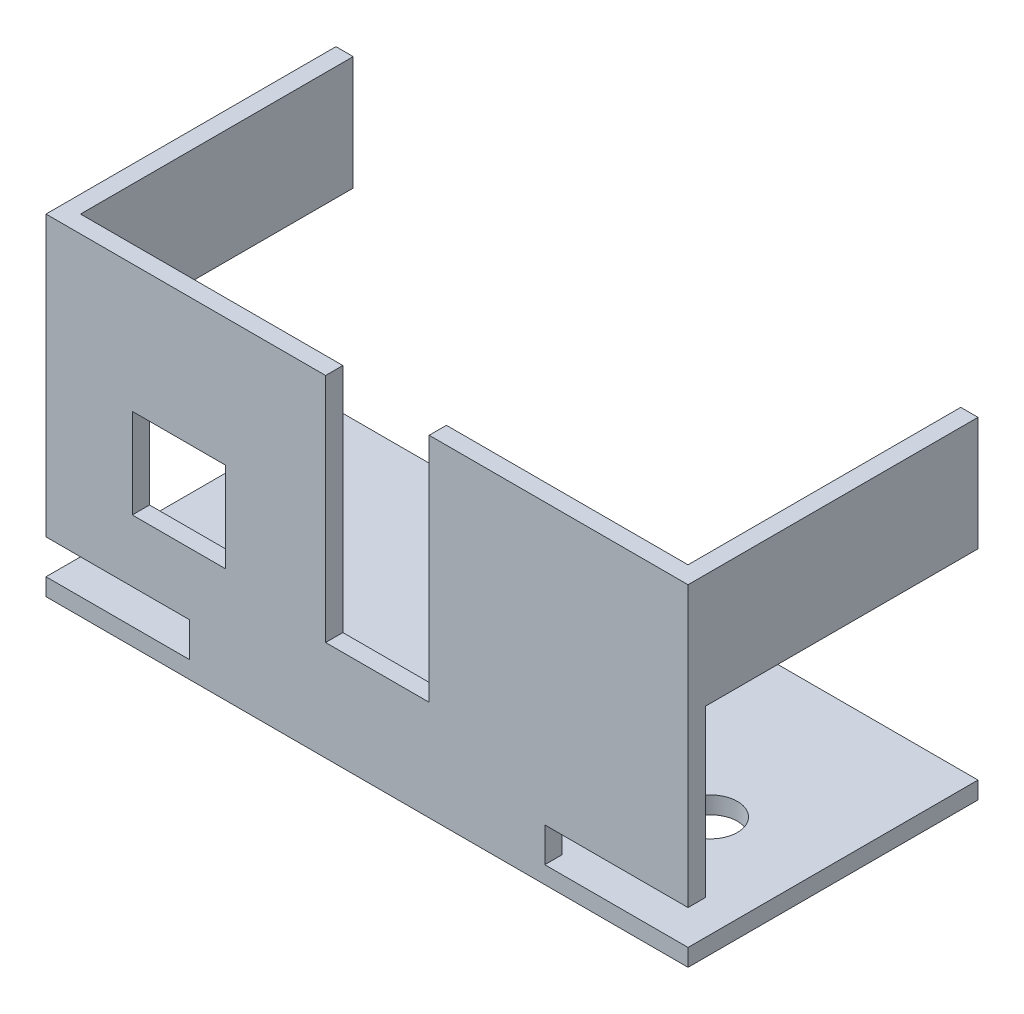
from build123d import *

# Parameters (mm, degrees)
SKETCH1_W           = 46.5
SKETCH1_H           = 24
BOSS_EXTRUDE1_DEPTH = 21
SHELL1_T            = -1.25
SKETCH2_W           = 19.75
SKETCH2_H           = 14.5
CUT_EXTRUDE1_DEPTH  = 57.384838388
SKETCH4_W           = 6.75
SKETCH4_H           = 6.5
SKETCH4_W_2         = 7.5
SKETCH4_H_2         = 17
CUT_EXTRUDE3_DEPTH  = 1.25
CUT_EXTRUDE4_REACH  = 57.358
SKETCH6_R           = 1.95
SKETCH7_W           = 10.375
SKETCH7_H           = 2.5
CUT_EXTRUDE5_DEPTH  = 1.25


with BuildPart() as part:
    # Sketch1 → Boss-Extrude1 (new body)
    with BuildSketch(Plane.XY):
        with Locations((22, 12)):
            Rectangle(SKETCH1_W, SKETCH1_H)
    extrude(amount=-BOSS_EXTRUDE1_DEPTH)

    # Shell1
    shell1_openings = [part.faces().sort_by_distance(p)[0] for p in [
        (22, 12, -21),
        (22, 24, -10.5),
    ]]
    offset(amount=SHELL1_T, openings=shell1_openings, kind=Kind.INTERSECTION)

    # Sketch2 → Cut-Extrude1 (cut, through all)
    with BuildSketch(Plane.ZY.offset(1.25)):
        with Locations((-11.125, 8.5)):
            Rectangle(SKETCH2_W, SKETCH2_H)
    extrude(amount=-CUT_EXTRUDE1_DEPTH, mode=Mode.SUBTRACT)

    # Sketch4 → Cut-Extrude3 (cut)
    with BuildSketch(Plane.XY):
        with Locations((8.375, 11.5)):
            Rectangle(SKETCH4_W, SKETCH4_H)
        with Locations((22.75, 15.75)):
            Rectangle(SKETCH4_W_2, SKETCH4_H_2)
    extrude(amount=-CUT_EXTRUDE3_DEPTH, mode=Mode.SUBTRACT)

    # Sketch6 → Cut-Extrude4 (cut, up to next)
    with BuildSketch(Plane(origin=(0, 0, 0), x_dir=(-1, 0, 0), z_dir=(0, -1, 0)), mode=Mode.PRIVATE) as cut_extrude4_sk1:
        with Locations(Location((-6.125, 9, 0), (0, 0, 90))):
            Circle(SKETCH6_R)
    cut_extrude4_tool1 = extrude(cut_extrude4_sk1.sketch, amount=-CUT_EXTRUDE4_REACH, mode=Mode.PRIVATE) & part.part
    # Sketch6 → Cut-Extrude4 (cut, up to next)
    with BuildSketch(Plane(origin=(0, 0, 0), x_dir=(-1, 0, 0), z_dir=(0, -1, 0)), mode=Mode.PRIVATE) as cut_extrude4_sk2:
        with Locations(Location((-37.875, 9, 0), (0, 0, 90))):
            Circle(SKETCH6_R)
    cut_extrude4_tool2 = extrude(cut_extrude4_sk2.sketch, amount=-CUT_EXTRUDE4_REACH, mode=Mode.PRIVATE) & part.part
    add(cut_extrude4_tool1.solids().sort_by_distance((6.125, 0, -9))[0], mode=Mode.SUBTRACT)
    add(cut_extrude4_tool2.solids().sort_by_distance((37.875, 0, -9))[0], mode=Mode.SUBTRACT)

    # Sketch7 → Cut-Extrude5 (cut)
    with BuildSketch(Plane.XY):
        with Locations((40.0625, 2.5)):
            Rectangle(SKETCH7_W, SKETCH7_H)
        with Locations((3.9375, 2.5)):
            Rectangle(SKETCH7_W, SKETCH7_H)
    extrude(amount=-CUT_EXTRUDE5_DEPTH, mode=Mode.SUBTRACT)


solid = part.part
